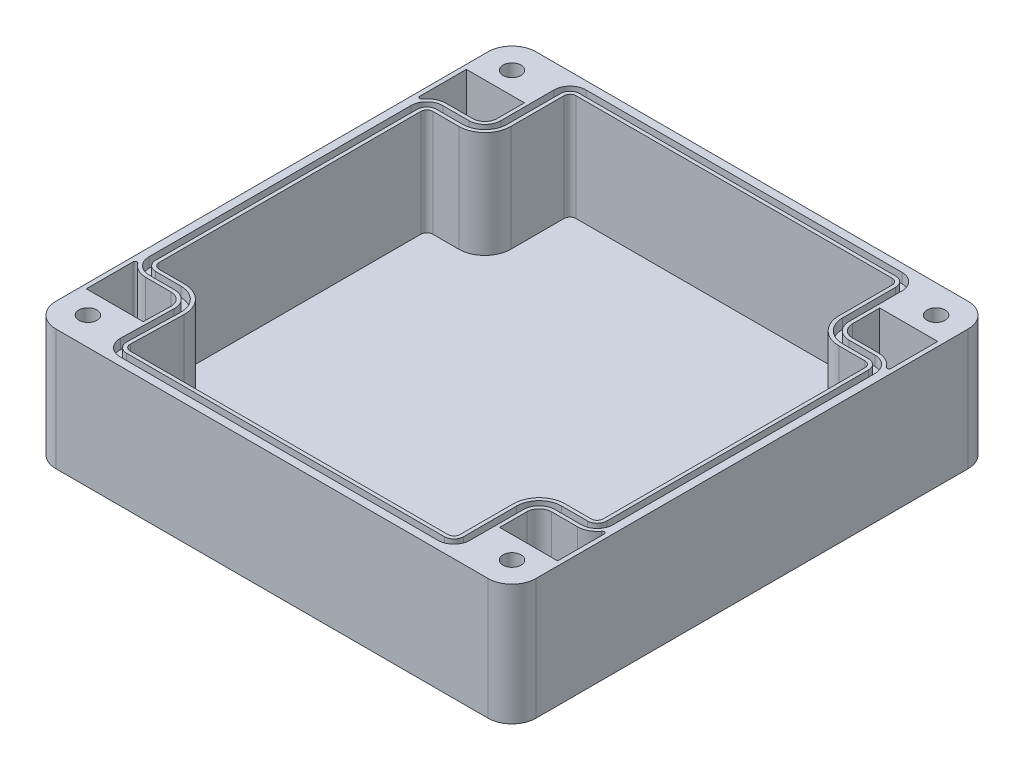
from build123d import *

# Parameters (mm, degrees)
SKETCH_1_R          = 2.25
EXTRUDE_1_DEPTH     = 30.25
CUT_EXTRUDE_1_DEPTH = 26.6
CUT_EXTRUDE_2_DEPTH = 2.5


with BuildPart() as part:
    # 草圖1 → 填料-伸長1 (new body)
    with BuildSketch(Plane(origin=(0, 0, 0), x_dir=(1, 0, 0), z_dir=(0, 1, 0))):
        with BuildLine():
            Line((6.340909091, 120.340909091), (114.340909091, 120.340909091))
            ThreePointArc((114.340909091, 120.340909091), (118.583549778, 118.583549778), (120.340909091, 114.340909091))
            Line((120.340909091, 114.340909091), (120.340909091, 6.340909091))
            ThreePointArc((120.340909091, 6.340909091), (118.583549778, 2.098268404), (114.340909091, 0.340909091))
            Line((114.340909091, 0.340909091), (6.340909091, 0.340909091))
            ThreePointArc((6.340909091, 0.340909091), (2.098268404, 2.098268404), (0.340909091, 6.340909091))
            Line((0.340909091, 6.340909091), (0.340909091, 114.340909091))
            ThreePointArc((0.340909091, 114.340909091), (2.098268404, 118.583549778), (6.340909091, 120.340909091))
        make_face()
        with Locations(Location((7.340909091, 113.340909091, 0), (0, 0, 270))):
            Circle(SKETCH_1_R, mode=Mode.SUBTRACT)
        with Locations(Location((113.340909091, 113.340909091, 0), (0, 0, 270))):
            Circle(SKETCH_1_R, mode=Mode.SUBTRACT)
        with Locations(Location((7.340909091, 7.340909091, 0), (0, 0, 270))):
            Circle(SKETCH_1_R, mode=Mode.SUBTRACT)
        with Locations(Location((113.340909091, 7.340909091, 0), (0, 0, 270))):
            Circle(SKETCH_1_R, mode=Mode.SUBTRACT)
    extrude(amount=EXTRUDE_1_DEPTH)

    # 草圖2 → 除料-伸長1 (cut)
    with BuildSketch(Plane(origin=(0, 30.25, 0), x_dir=(1, 0, 0), z_dir=(0, 1, 0))):
        with BuildLine():
            Line((15.940908992, 101.053812481), (15.940908992, 107.840909091))
            Line((15.940908992, 107.840909091), (1.440909091, 107.840909091))
            Line((1.440909091, 107.840909091), (1.440909091, 96.184307649))
            ThreePointArc((1.440909091, 96.184307649), (1.788763936, 95.708017977), (2.348316498, 95.894446985))
            ThreePointArc((2.348316498, 95.894446985), (4.094702185, 97.408643653), (6.340909091, 97.953812481))
            Line((6.340909091, 97.953812481), (12.840908992, 97.953812481))
            ThreePointArc((12.840908992, 97.953812481), (15.032940014, 98.861781459), (15.940908992, 101.053812481))
        make_face()
        with BuildLine():
            Line((6.328095563, 22.75810538), (12.727920948, 22.741369743))
            ThreePointArc((12.727920948, 22.741369743), (14.940810853, 21.804058056), (15.818922369, 19.567016463))
            Line((15.818922369, 19.567016463), (15.65752772, 12.840909091))
            Line((15.65752772, 12.840909091), (1.440909091, 12.840909091))
            Line((1.440909091, 12.840909091), (1.440909091, 24.527593458))
            ThreePointArc((1.440909091, 24.527593458), (1.788763936, 25.00388313), (2.348316498, 24.817454121))
            ThreePointArc((2.348316498, 24.817454121), (4.089010146, 23.306198101), (6.328095563, 22.75810538))
        make_face()
        with BuildLine():
            Line((99.84090919, 115.840909091), (20.840908992, 115.840909091))
            ThreePointArc((20.840908992, 115.840909091), (19.78024882, 115.401569263), (19.340908992, 114.340909091))
            Line((19.340908992, 114.340909091), (19.340908992, 101.053812481))
            ThreePointArc((19.340908992, 101.053812481), (17.43710307, 96.457618403), (12.840908992, 94.553812481))
            Line((12.840908992, 94.553812481), (6.340909091, 94.553812481))
            ThreePointArc((6.340909091, 94.553812481), (5.280248919, 94.114472652), (4.840909091, 93.053812481))
            Line((4.840909091, 93.053812481), (4.840909091, 27.658088626))
            ThreePointArc((4.840909091, 27.658088626), (5.278863008, 26.598816178), (6.336986582, 26.158093755))
            Line((6.336986582, 26.158093755), (12.736811967, 26.141358118))
            ThreePointArc((12.736811967, 26.141358118), (17.376742412, 24.176027162), (19.217943979, 19.485456079))
            Line((19.217943979, 19.485456079), (18.903400656, 6.376891613))
            ThreePointArc((18.903400656, 6.376891613), (19.32966249, 5.293047884), (20.402969013, 4.840909091))
            Line((20.402969013, 4.840909091), (99.84090919, 4.840909091))
            ThreePointArc((99.84090919, 4.840909091), (100.901569362, 5.280248919), (101.34090919, 6.340909091))
            Line((101.34090919, 6.340909091), (101.34090919, 19.628005701))
            ThreePointArc((101.34090919, 19.628005701), (103.244715112, 24.224199779), (107.84090919, 26.128005701))
            Line((107.84090919, 26.128005701), (114.340909091, 26.128005701))
            ThreePointArc((114.340909091, 26.128005701), (115.401569263, 26.567345529), (115.840909091, 27.628005701))
            Line((115.840909091, 27.628005701), (115.840909091, 93.053812481))
            ThreePointArc((115.840909091, 93.053812481), (115.401569263, 94.114472652), (114.340909091, 94.553812481))
            Line((114.340909091, 94.553812481), (107.84090919, 94.553812481))
            ThreePointArc((107.84090919, 94.553812481), (103.244715112, 96.457618403), (101.34090919, 101.053812481))
            Line((101.34090919, 101.053812481), (101.34090919, 114.340909091))
            ThreePointArc((101.34090919, 114.340909091), (100.901569362, 115.401569263), (99.84090919, 115.840909091))
        make_face()
        with BuildLine():
            Line((104.74090919, 19.628005701), (104.74090919, 12.840909091))
            Line((104.74090919, 12.840909091), (119.240909091, 12.840909091))
            Line((119.240909091, 12.840909091), (119.240909091, 24.497510533))
            ThreePointArc((119.240909091, 24.497510533), (118.893054246, 24.973800205), (118.333501683, 24.787371196))
            ThreePointArc((118.333501683, 24.787371196), (116.587115997, 23.273174529), (114.340909091, 22.728005701))
            Line((114.340909091, 22.728005701), (107.84090919, 22.728005701))
            ThreePointArc((107.84090919, 22.728005701), (105.648878168, 21.820036723), (104.74090919, 19.628005701))
        make_face()
        with BuildLine():
            Line((114.340909091, 97.953812481), (107.84090919, 97.953812481))
            ThreePointArc((107.84090919, 97.953812481), (105.648878168, 98.861781459), (104.74090919, 101.053812481))
            Line((104.74090919, 101.053812481), (104.74090919, 107.840909091))
            Line((104.74090919, 107.840909091), (119.240909091, 107.840909091))
            Line((119.240909091, 107.840909091), (119.240909091, 96.184307649))
            ThreePointArc((119.240909091, 96.184307649), (118.893054246, 95.708017977), (118.333501683, 95.894446985))
            ThreePointArc((118.333501683, 95.894446985), (116.587115997, 97.408643653), (114.340909091, 97.953812481))
        make_face()
    extrude(amount=-CUT_EXTRUDE_1_DEPTH, mode=Mode.SUBTRACT)

    # 草圖3 → 除料-伸長2 (cut)
    with BuildSketch(Plane(origin=(0, 30.25, 0), x_dir=(1, 0, 0), z_dir=(0, 1, 0))):
        with BuildLine():
            Line((103.84090919, 101.053812481), (103.84090919, 114.340909091))
            ThreePointArc((103.84090919, 114.340909091), (102.669336315, 117.169336216), (99.84090919, 118.340909091))
            Line((99.84090919, 118.340909091), (20.840908992, 118.340909091))
            ThreePointArc((20.840908992, 118.340909091), (18.012481867, 117.169336216), (16.840908992, 114.340909091))
            Line((16.840908992, 114.340909091), (16.840908992, 101.053812481))
            ThreePointArc((16.840908992, 101.053812481), (15.669336117, 98.225385356), (12.840908992, 97.053812481))
            Line((12.840908992, 97.053812481), (6.340909091, 97.053812481))
            ThreePointArc((6.340909091, 97.053812481), (3.512481966, 95.882239605), (2.340909091, 93.053812481))
            Line((2.340909091, 93.053812481), (2.340909091, 27.658088626))
            ThreePointArc((2.340909091, 27.658088626), (3.508786204, 24.833362099), (6.330449068, 23.658102303))
            Line((6.330449068, 23.658102303), (12.730274453, 23.641366666))
            ThreePointArc((12.730274453, 23.641366666), (15.585616265, 22.431932231), (16.718663383, 19.545426949))
            Line((16.718663383, 19.545426949), (16.40412006, 6.436862484))
            ThreePointArc((16.40412006, 6.436862484), (17.540818286, 3.54661254), (20.402969013, 2.340909091))
            Line((20.402969013, 2.340909091), (99.84090919, 2.340909091))
            ThreePointArc((99.84090919, 2.340909091), (102.669336315, 3.512481966), (103.84090919, 6.340909091))
            Line((103.84090919, 6.340909091), (103.84090919, 19.628005701))
            ThreePointArc((103.84090919, 19.628005701), (105.012482065, 22.456432826), (107.84090919, 23.628005701))
            Line((107.84090919, 23.628005701), (114.340909091, 23.628005701))
            ThreePointArc((114.340909091, 23.628005701), (117.169336216, 24.799578576), (118.340909091, 27.628005701))
            Line((118.340909091, 27.628005701), (118.340909091, 93.053812481))
            ThreePointArc((118.340909091, 93.053812481), (117.169336216, 95.882239605), (114.340909091, 97.053812481))
            Line((114.340909091, 97.053812481), (107.84090919, 97.053812481))
            ThreePointArc((107.84090919, 97.053812481), (105.012482065, 98.225385356), (103.84090919, 101.053812481))
        make_face()
        with BuildLine():
            Line((114.340909091, 95.453812481), (107.84090919, 95.453812481))
            ThreePointArc((107.84090919, 95.453812481), (103.881111215, 97.094014506), (102.24090919, 101.053812481))
            Line((102.24090919, 101.053812481), (102.24090919, 114.340909091))
            ThreePointArc((102.24090919, 114.340909091), (101.537965465, 116.037965366), (99.84090919, 116.740909091))
            Line((99.84090919, 116.740909091), (20.840908992, 116.740909091))
            ThreePointArc((20.840908992, 116.740909091), (19.143852717, 116.037965366), (18.440908992, 114.340909091))
            Line((18.440908992, 114.340909091), (18.440908992, 101.053812481))
            ThreePointArc((18.440908992, 101.053812481), (16.800706967, 97.094014506), (12.840908992, 95.453812481))
            Line((12.840908992, 95.453812481), (6.340909091, 95.453812481))
            ThreePointArc((6.340909091, 95.453812481), (4.643852816, 94.750868756), (3.940909091, 93.053812481))
            Line((3.940909091, 93.053812481), (3.940909091, 27.658088626))
            ThreePointArc((3.940909091, 27.658088626), (4.641635359, 25.96325271), (6.334633077, 25.258096832))
            Line((6.334633077, 25.258096832), (12.734458462, 25.241361195))
            ThreePointArc((12.734458462, 25.241361195), (16.731936999, 23.548152987), (18.318202964, 19.507045592))
            Line((18.318202964, 19.507045592), (18.003659641, 6.398481127))
            ThreePointArc((18.003659641, 6.398481127), (18.685678577, 4.66433116), (20.402969013, 3.940909091))
            Line((20.402969013, 3.940909091), (99.84090919, 3.940909091))
            ThreePointArc((99.84090919, 3.940909091), (101.537965465, 4.643852816), (102.24090919, 6.340909091))
            Line((102.24090919, 6.340909091), (102.24090919, 19.628005701))
            ThreePointArc((102.24090919, 19.628005701), (103.881111215, 23.587803676), (107.84090919, 25.228005701))
            Line((107.84090919, 25.228005701), (114.340909091, 25.228005701))
            ThreePointArc((114.340909091, 25.228005701), (116.037965366, 25.930949426), (116.740909091, 27.628005701))
            Line((116.740909091, 27.628005701), (116.740909091, 93.053812481))
            ThreePointArc((116.740909091, 93.053812481), (116.037965366, 94.750868756), (114.340909091, 95.453812481))
        make_face(mode=Mode.SUBTRACT)
    extrude(amount=-CUT_EXTRUDE_2_DEPTH, mode=Mode.SUBTRACT)


solid = part.part
